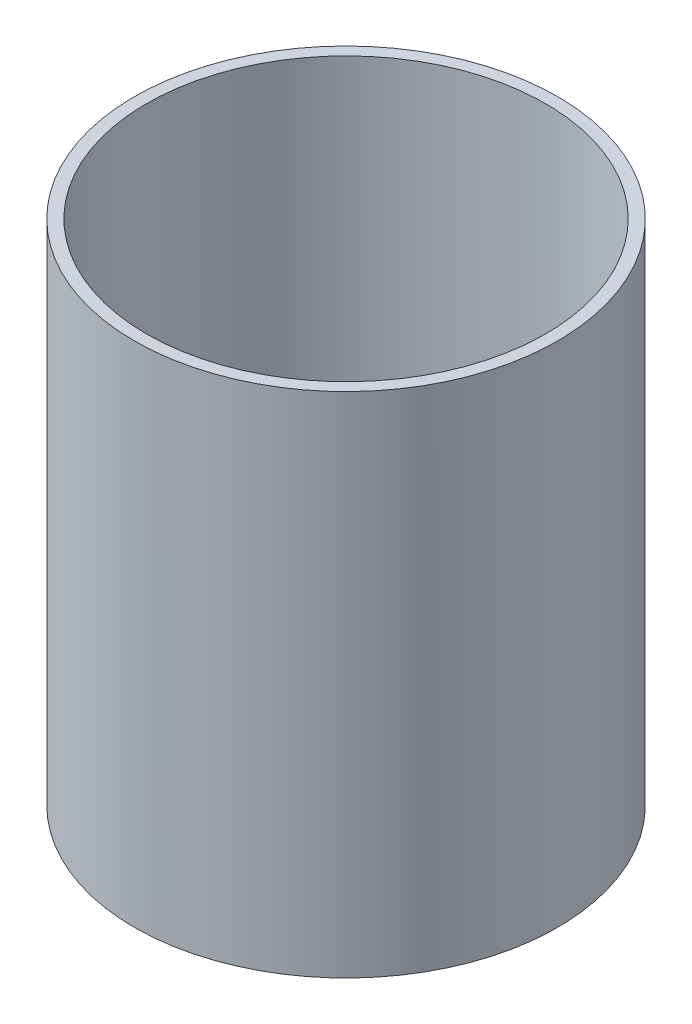
from build123d import *

# Parameters (mm, degrees)
SKETCH1_R               = 17.78
BOSS_EXTRUDE1_DEPTH     = 50.8
SKETCH2_R               = 16.764
CUT_EXTRUDE1_DEPTH      = 177.8
CUT_EXTRUDE3_DEPTH      = 8.128
CUT_EXTRUDE5_DEPTH      = 8.128
CUT_EXTRUDE6_DEPTH      = 57.682420555
CUT_EXTRUDE6_DEPTH_BACK = 57.682420555
SKETCH8_W               = 2.16473232
SKETCH8_H               = 8.128


with BuildPart() as part:
    # Sketch1 → Boss-Extrude1 (new body)
    with BuildSketch(Plane(origin=(0, 0, 0), x_dir=(1, 0, 0), z_dir=(0, 1, 0))):
        with Locations(Location((0, 0, 0), (0, 0, 270))):
            Circle(SKETCH1_R)
    extrude(amount=BOSS_EXTRUDE1_DEPTH)

    # Sketch2 → Cut-Extrude1 (cut)
    with BuildSketch(Plane(origin=(0, 50.8, 0), x_dir=(1, 0, 0), z_dir=(0, 1, 0))):
        with Locations(Location((0, 0, 0), (0, 0, 270))):
            Circle(SKETCH2_R)
    extrude(amount=-CUT_EXTRUDE1_DEPTH, mode=Mode.SUBTRACT)

    # Sketch5 → Cut-Extrude3 (cut)
    with BuildSketch(Plane(origin=(0, 0, 0), x_dir=(1, 0, 0), z_dir=(0, 1, 0))):
        with BuildLine():
            Line((17.78, 2.54), (-17.78, 2.54))
            ThreePointArc((-17.78, 2.54), (0, 20.32), (17.78, 2.54))
        make_face()
    extrude(amount=CUT_EXTRUDE3_DEPTH, mode=Mode.SUBTRACT)

    # Sketch6 → Cut-Extrude5 (cut)
    with BuildSketch(Plane(origin=(0, 0, 0), x_dir=(1, 0, 0), z_dir=(0, 1, 0))):
        with BuildLine():
            Line((17.78, -2.54), (-17.78, -2.54))
            ThreePointArc((-17.78, -2.54), (0, -18.882130931), (17.78, -2.54))
        make_face()
    extrude(amount=CUT_EXTRUDE5_DEPTH, mode=Mode.SUBTRACT)

    # Sketch8 → Cut-Extrude6 (cut, two sides: drawn at the far end of the back side and taken through both)
    with BuildSketch(Plane.XY.offset(-CUT_EXTRUDE6_DEPTH_BACK)):
        with Locations((17.267156574, 4.064)):
            Rectangle(SKETCH8_W, SKETCH8_H)
    extrude(amount=CUT_EXTRUDE6_DEPTH + CUT_EXTRUDE6_DEPTH_BACK, mode=Mode.SUBTRACT)


solid = part.part
